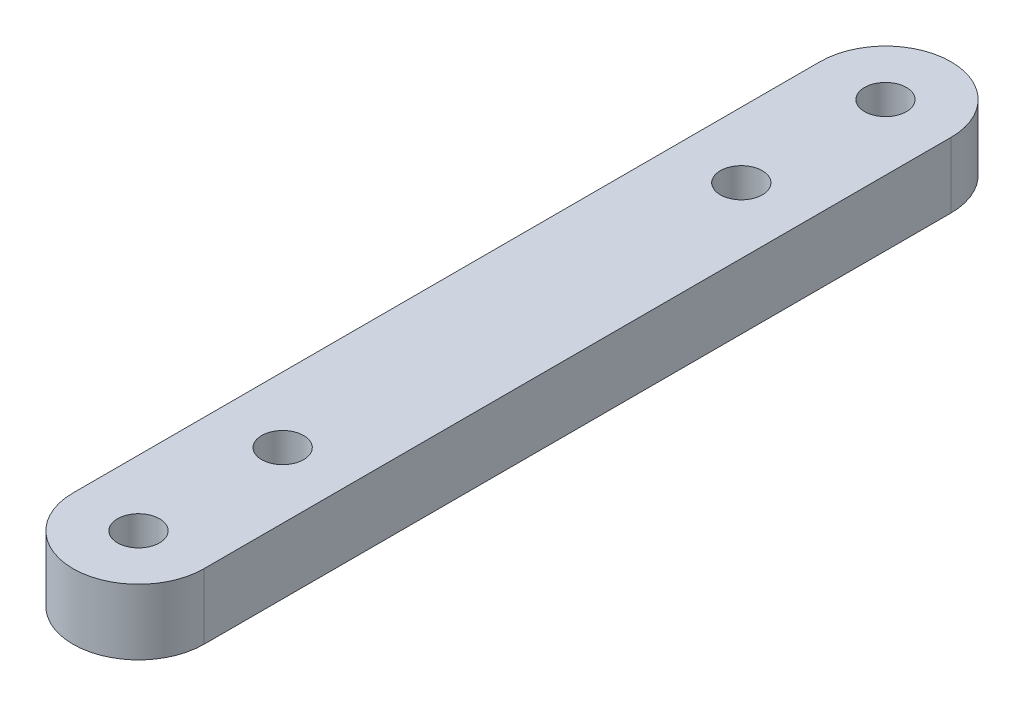
from build123d import *

# Parameters (mm, degrees)
SKIZZE2_R                       = 1.6
AUFSATZ_LINEAR_AUSTRAGEN1_DEPTH = 5
SKIZZE3_R                       = 3
SCHNITT_LINEAR_AUSTRAGEN1_DEPTH = 2.5


with BuildPart() as part:
    # Skizze2 → Aufsatz-Linear austragen1 (new body)
    with BuildSketch(Plane(origin=(0, 0, 0), x_dir=(1, 0, 0), z_dir=(0, 1, 0))):
        with BuildLine():
            Line((-4, 28.5), (-4, -28.5))
            ThreePointArc((-4, -28.5), (1, -33.5), (6, -28.5))
            Line((6, -28.5), (6, 28.5))
            ThreePointArc((6, 28.5), (1, 33.5), (-4, 28.5))
        make_face()
        with Locations(Location((1, 28.5, 0), (0, 0, 270))):
            Circle(SKIZZE2_R, mode=Mode.SUBTRACT)
        with Locations(Location((1, 17.5, 0), (0, 0, 270))):
            Circle(SKIZZE2_R, mode=Mode.SUBTRACT)
        with Locations(Location((1, -17.5, 0), (0, 0, 90))):
            Circle(SKIZZE2_R, mode=Mode.SUBTRACT)
        with Locations(Location((1, -28.5, 0), (0, 0, 90))):
            Circle(SKIZZE2_R, mode=Mode.SUBTRACT)
    extrude(amount=AUFSATZ_LINEAR_AUSTRAGEN1_DEPTH)

    # Skizze3 → Schnitt-Linear austragen1 (cut)
    with BuildSketch(Plane.XZ):
        with Locations(Location((1, 17.5, 0), (0, 0, 270))):
            Circle(SKIZZE3_R)
        with Locations(Location((1, -17.5, 0), (0, 0, 270))):
            Circle(SKIZZE3_R)
    extrude(amount=-SCHNITT_LINEAR_AUSTRAGEN1_DEPTH, mode=Mode.SUBTRACT)


solid = part.part
